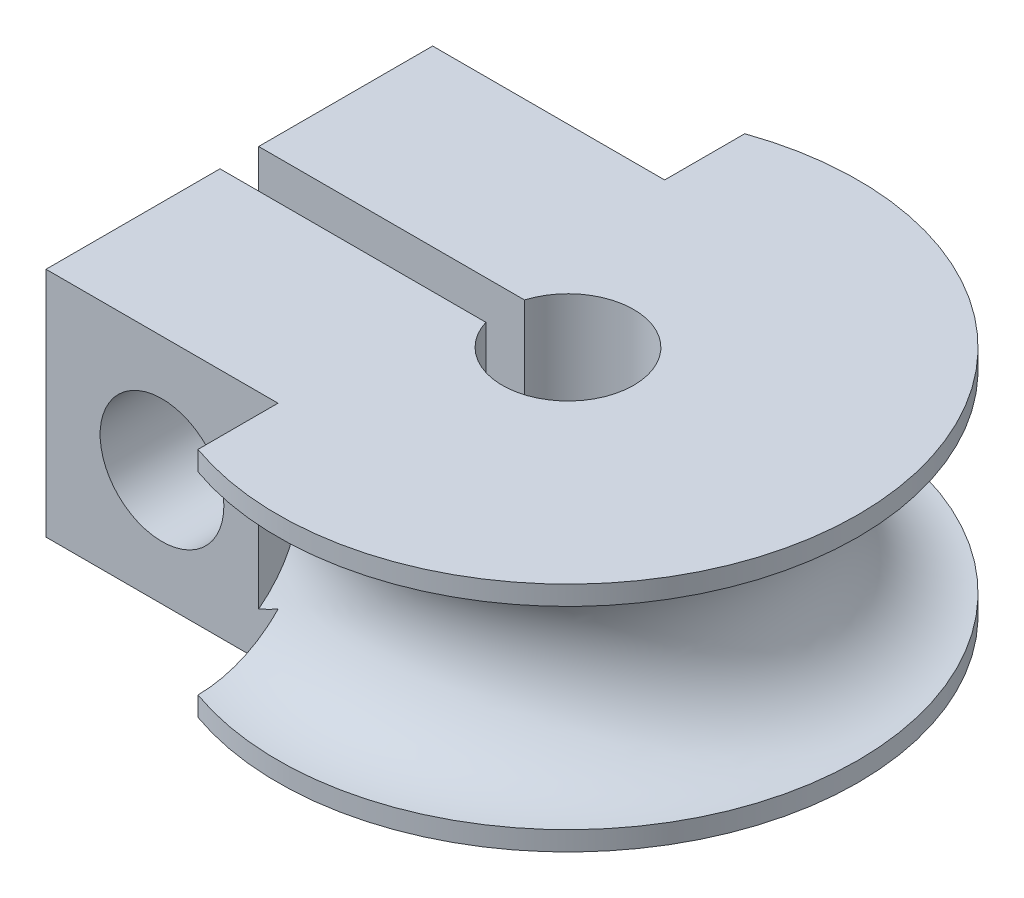
from build123d import *

# Parameters (mm, degrees)
CLAMP_EXTRUSION_DEPTH      = 5
CLAMP_EXTRUSION_DEPTH_BACK = 5
SKETCH2_W                  = 5.5
SKETCH2_H                  = 6
SKETCH3_W                  = 6
SKETCH3_H                  = 2.071067812
SKETCH3_W_2                = 8.5
SKETCH3_H_2                = 1
CLAMP_CUTOUT_DEPTH         = 14.067134468
CLAMP_HOLE_D               = 3.2


with BuildPart() as part:
    # Sketch1 → body (revolve)
    with BuildSketch(Plane.XY):
        with BuildLine():
            Line((3, 0), (4, 0))
            Line((4, 0), (4, 0.5))
            Line((4, 0.5), (7.5, 0.5))
            Line((7.5, 0.5), (7.5, 1))
            ThreePointArc((7.5, 1), (5, 3.5), (7.5, 6))
            Line((7.5, 6), (7.5, 6.5))
            Line((7.5, 6.5), (1.7, 6.5))
            Line((1.7, 6.5), (1.7, 4))
            Line((1.7, 4), (3, 4))
            Line((3, 4), (3, 0))
        make_face()
    revolve(axis=Axis((0, 0, 0), (0, 1, 0)))

    # Sketch2 → clamp_extrusion (add, two sides: drawn at the far end of the back side and taken through both)
    with BuildSketch(Plane.XY.offset(-CLAMP_EXTRUSION_DEPTH_BACK)):
        with Locations((-5.75, 3.5)):
            Rectangle(SKETCH2_W, SKETCH2_H)
    extrude(amount=CLAMP_EXTRUSION_DEPTH + CLAMP_EXTRUSION_DEPTH_BACK)

    # Sketch3 → clamp_cutout (cut, through all)
    with BuildSketch(Plane(origin=(0, 6.5, 0), x_dir=(1, 0, 0), z_dir=(0, 1, 0))):
        with Locations((-5.5, 6.035533906)):
            Rectangle(SKETCH3_W, SKETCH3_H)
        with Locations((-5.5, -6.035533906)):
            Rectangle(SKETCH3_W, SKETCH3_H)
        with Locations((-4.25, 0)):
            Rectangle(SKETCH3_W_2, SKETCH3_H_2)
    extrude(amount=-CLAMP_CUTOUT_DEPTH, mode=Mode.SUBTRACT)

    # clamp_hole (through all)
    with Locations(Plane.XY.offset(5)):
        with Locations((-5.5, 3.5)):
            Hole(CLAMP_HOLE_D / 2)


solid = part.part
